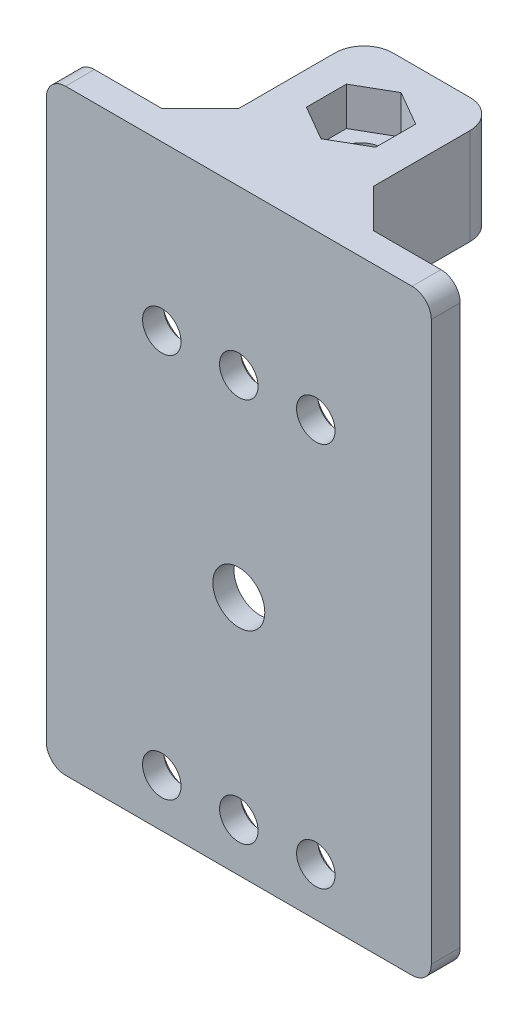
from build123d import *

# Parameters (mm, degrees)
SKETCH_1_W          = 40
SKETCH_1_H          = 62
SKETCH_1_R          = 2
SKETCH_1_R_2        = 2.7
EXTRUDE_1_DEPTH     = 3
SKETCH_3_W          = 14
SKETCH_3_H          = 10
EXTRUDE_2_DEPTH     = 17
CUT_EXTRUDE_START   = -10
CUT_EXTRUDE_1_DEPTH = 4
CUT_EXTRUDE_2_REACH = 65.663
SKETCH_6_R          = 2.2
FILLET_1_R          = 3
CHAMFER_1_SIZE      = 4
CUT_EXTRUDE_3_DEPTH = 3
FILLET_2_R          = 2
SKETCH_7_R          = 5
SKETCH_7_R_2        = 3
CUT_EXTRUDE_4_DEPTH = 0.8


with BuildPart() as part:
    # 草图1 → 凸台-拉伸1 (new body)
    with BuildSketch(Plane.XY):
        with Locations((0, 6)):
            Rectangle(SKETCH_1_W, SKETCH_1_H)
        with Locations((0, 20)):
            Circle(SKETCH_1_R, mode=Mode.SUBTRACT)
        with Locations((8, 20)):
            Circle(SKETCH_1_R, mode=Mode.SUBTRACT)
        with Locations((-8, -20)):
            Circle(SKETCH_1_R, mode=Mode.SUBTRACT)
        with Locations((0, -20)):
            Circle(SKETCH_1_R, mode=Mode.SUBTRACT)
        with Locations((8, -20)):
            Circle(SKETCH_1_R, mode=Mode.SUBTRACT)
        with Locations((-8, 20)):
            Circle(SKETCH_1_R, mode=Mode.SUBTRACT)
        Circle(SKETCH_1_R_2, mode=Mode.SUBTRACT)
    extrude(amount=EXTRUDE_1_DEPTH)

    # 草图3 → 凸台-拉伸2 (add)
    with BuildSketch(Plane(origin=(0, 0, 0), x_dir=(-1, 0, 0), z_dir=(0, 0, -1))):
        with Locations((0, 32)):
            Rectangle(SKETCH_3_W, SKETCH_3_H)
    extrude(amount=EXTRUDE_2_DEPTH)

    # 草图5 → 切除-拉伸1 (cut)
    with BuildSketch(Plane.XZ.offset(-27).offset(CUT_EXTRUDE_START)):
        Polygon((3.6, -11.778460969), (3.6, -7.621539031), (0, -5.543078062), (-3.6, -7.621539031), (-3.6, -11.778460969), (0, -13.856921938), align=None)
    extrude(amount=CUT_EXTRUDE_1_DEPTH, mode=Mode.SUBTRACT)

    # 草图6 → 切除-拉伸2 (cut, up to next)
    with BuildSketch(Plane(origin=(0, 33, 0), x_dir=(-1, 0, 0), z_dir=(0, 1, 0)), mode=Mode.PRIVATE) as cut_extrude_2_sk1:
        with Locations(Location((0, -9.7, 0), (0, 0, 90))):
            Circle(SKETCH_6_R)
    cut_extrude_2_tool1 = extrude(cut_extrude_2_sk1.sketch, amount=-CUT_EXTRUDE_2_REACH, mode=Mode.PRIVATE) & part.part
    add(cut_extrude_2_tool1.solids().sort_by_distance((0, 33, -9.7))[0], mode=Mode.SUBTRACT)

    # 圆角1
    fillet_1_edges = [part.edges().sort_by_distance(p)[0] for p in [
        (-7, 32, -17),
        (7, 32, -17),
    ]]
    fillet(fillet_1_edges, radius=FILLET_1_R)

    # 倒角1
    chamfer_1_edges = [part.edges().sort_by_distance(p)[0] for p in [
        (-7, 32, 0),
        (7, 32, 0),
    ]]
    chamfer(chamfer_1_edges, length=CHAMFER_1_SIZE)

    # 草图5<2> → 切除-拉伸3 (cut)
    with BuildSketch(Plane.XZ.offset(-27)):
        Polygon((3.6, -11.778460969), (3.6, -7.621539031), (0, -5.543078062), (-3.6, -7.621539031), (-3.6, -11.778460969), (0, -13.856921938), align=None)
    extrude(amount=-CUT_EXTRUDE_3_DEPTH, mode=Mode.SUBTRACT)

    # 圆角2
    fillet_2_edges = [part.edges().sort_by_distance(p)[0] for p in [
        (-20, 37, 1.5),
        (20, 37, 1.5),
        (20, -25, 1.5),
        (-20, -25, 1.5),
    ]]
    fillet(fillet_2_edges, radius=FILLET_2_R)

    # 草图7 → 切除-拉伸4 (cut)
    with BuildSketch(Plane(origin=(0, 0, 0), x_dir=(-1, 0, 0), z_dir=(0, 0, -1))):
        Circle(SKETCH_7_R)
        with Locations((-8, 20)):
            Circle(SKETCH_7_R_2)
        with Locations((0, 20)):
            Circle(SKETCH_7_R_2)
        with Locations(Location((8, 20, 0), (0, 0, 180))):
            Circle(SKETCH_7_R_2)
        with Locations((8, -20)):
            Circle(SKETCH_7_R_2)
        with Locations(Location((0, -20, 0), (0, 0, 180))):
            Circle(SKETCH_7_R_2)
        with Locations(Location((-8, -20, 0), (0, 0, 180))):
            Circle(SKETCH_7_R_2)
    extrude(amount=-CUT_EXTRUDE_4_DEPTH, mode=Mode.SUBTRACT)


solid = part.part
